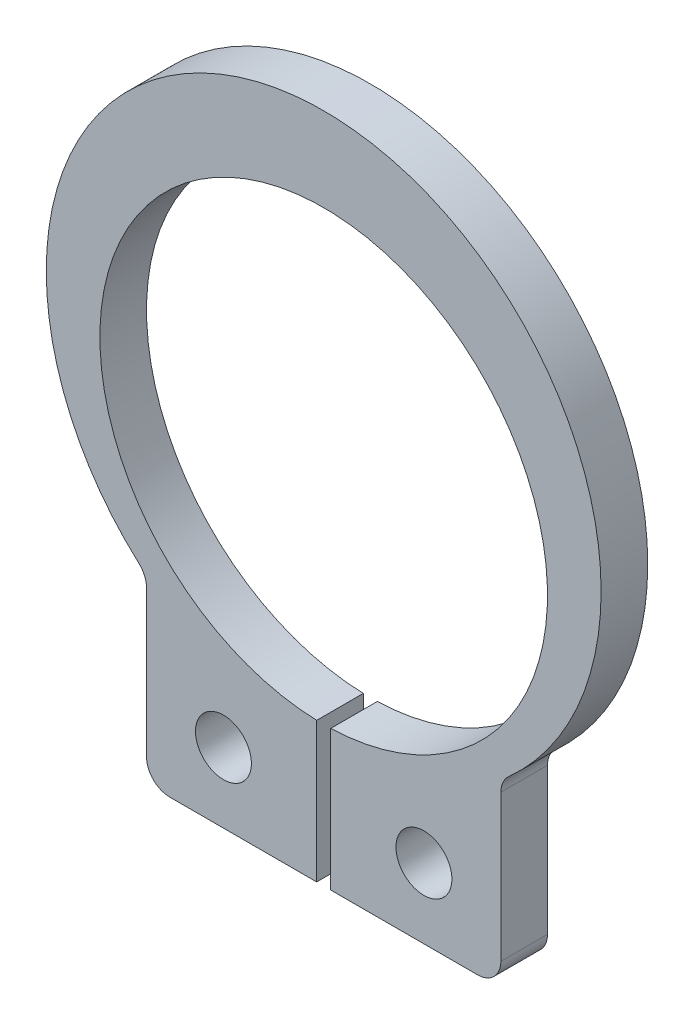
from build123d import *

# Parameters (mm, degrees)
BOSS_EXTRUDE1_DEPTH = 1
SKETCH2_R           = 0.6
CUT_EXTRUDE1_DEPTH  = 10.861161189


with BuildPart() as part:
    # Sketch1 → Boss-Extrude1 (new body)
    with BuildSketch(Plane.XY):
        with BuildLine():
            Line((-3.8, -4.157546152), (-3.8, -7.3))
            ThreePointArc((-3.8, -7.3), (-3.653553391, -7.653553391), (-3.3, -7.8))
            Line((-3.3, -7.8), (-0.15, -7.8))
            Line((-0.15, -7.8), (-0.15, -4.797655678))
            ThreePointArc((-0.15, -4.797655678), (0, 4.8), (0.15, -4.797655678))
            Line((0.15, -4.797655678), (0.15, -7.8))
            Line((0.15, -7.8), (3.3, -7.8))
            ThreePointArc((3.3, -7.8), (3.653553391, -7.653553391), (3.8, -7.3))
            Line((3.8, -7.3), (3.8, -4.157546152))
            ThreePointArc((3.8, -4.157546152), (3.843564535, -3.953422006), (3.966666667, -3.784868155))
            ThreePointArc((3.966666667, -3.784868155), (0, 6.6), (-3.966666667, -3.784868155))
            ThreePointArc((-3.966666667, -3.784868155), (-3.843564535, -3.953422006), (-3.8, -4.157546152))
        make_face()
    extrude(amount=-BOSS_EXTRUDE1_DEPTH)

    # Sketch2 → Cut-Extrude1 (cut, through all)
    with BuildSketch(Plane.XY):
        with Locations((-2.15, -6.3)):
            Circle(SKETCH2_R)
        with Locations((2.15, -6.3)):
            Circle(SKETCH2_R)
    extrude(amount=-CUT_EXTRUDE1_DEPTH, mode=Mode.SUBTRACT)


solid = part.part
